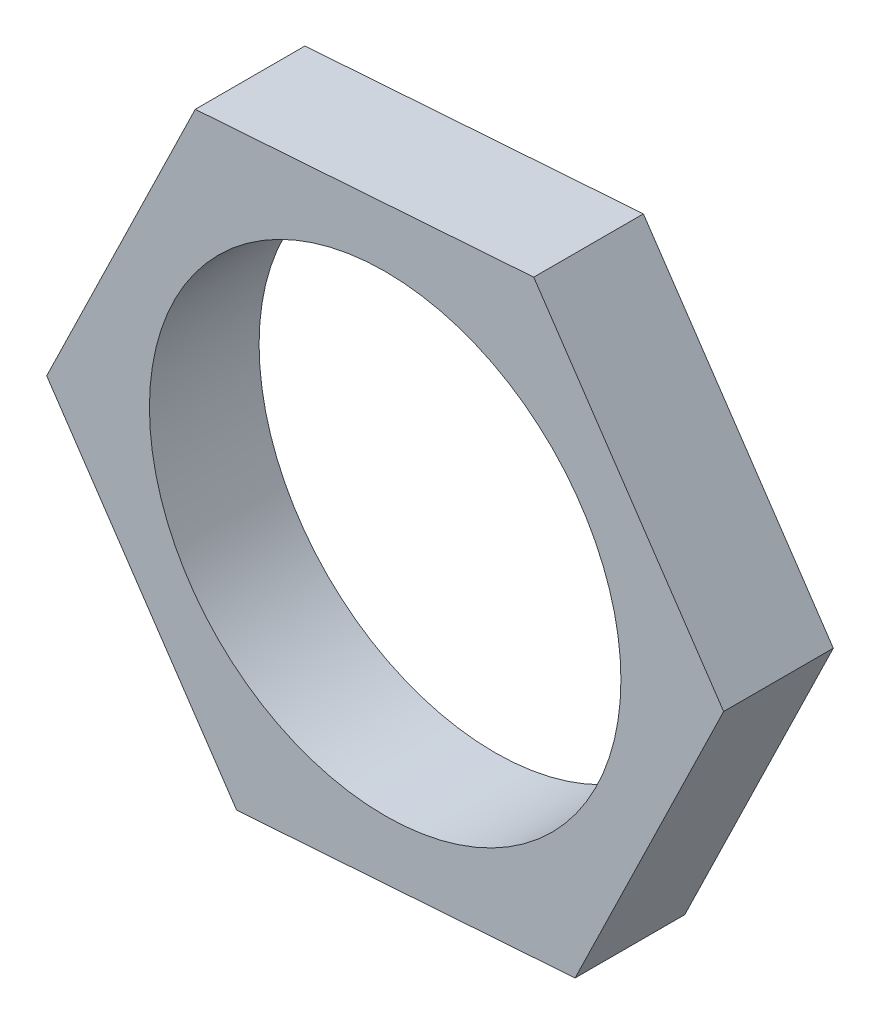
from build123d import *

# Parameters (mm, degrees)
SKETCH1_R           = 10.75
BOSS_EXTRUDE1_DEPTH = 5


with BuildPart() as part:
    # Sketch1 → Boss-Extrude1 (new body)
    with BuildSketch(Plane.XY):
        Polygon((6.774499028, 13.911128504), (-8.660141166, 12.822452508), (-15.434640194, -1.088675996), (-6.774499028, -13.911128504), (8.660141166, -12.822452508), (15.434640194, 1.088675996), align=None)
        Circle(SKETCH1_R, mode=Mode.SUBTRACT)
    extrude(amount=BOSS_EXTRUDE1_DEPTH)


solid = part.part
